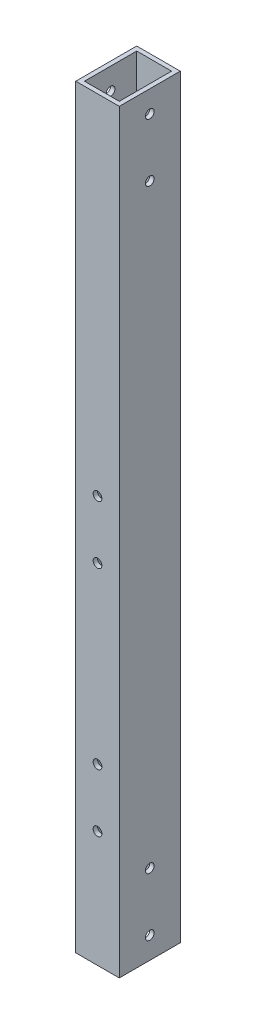
from build123d import *

# Parameters (mm, degrees)
SKETCH_1_W          = 15
SKETCH_1_H          = 21
SKETCH_1_W_2        = 12
SKETCH_1_H_2        = 18
EXTRUDE_1_DEPTH     = 260
SKETCH_4_R          = 1.5
CUT_EXTRUDE_2_DEPTH = 261.643914182
SKETCH_5_R          = 1.5
CUT_EXTRUDE_3_DEPTH = 261.954497949


with BuildPart() as part:
    # 草图1 → 拉伸-薄壁1 (new body)
    with BuildSketch(Plane(origin=(0, 0, 0), x_dir=(1, 0, 0), z_dir=(0, 1, 0))):
        Rectangle(SKETCH_1_W, SKETCH_1_H)
        Rectangle(SKETCH_1_W_2, SKETCH_1_H_2, mode=Mode.SUBTRACT)
    extrude(amount=EXTRUDE_1_DEPTH)

    # 草图4 → 切除-拉伸2 (cut, through all)
    with BuildSketch(Plane(origin=(7.5, 0, 0), x_dir=(0, 0, -1), z_dir=(1, 0, 0))):
        with Locations((0, 252.5)):
            Circle(SKETCH_4_R)
        with Locations((0, 232.5)):
            Circle(SKETCH_4_R)
        with Locations((0, 27.5)):
            Circle(SKETCH_4_R)
        with Locations((0, 7.5)):
            Circle(SKETCH_4_R)
    extrude(amount=-CUT_EXTRUDE_2_DEPTH, mode=Mode.SUBTRACT)

    # 草图5 → 切除-拉伸3 (cut, through all)
    with BuildSketch(Plane.XY.offset(10.5)):
        with Locations((0, 40)):
            Circle(SKETCH_5_R)
        with Locations((0, 60)):
            Circle(SKETCH_5_R)
        with Locations((0, 120)):
            Circle(SKETCH_5_R)
        with Locations((0, 140)):
            Circle(SKETCH_5_R)
    extrude(amount=-CUT_EXTRUDE_3_DEPTH, mode=Mode.SUBTRACT)


solid = part.part
